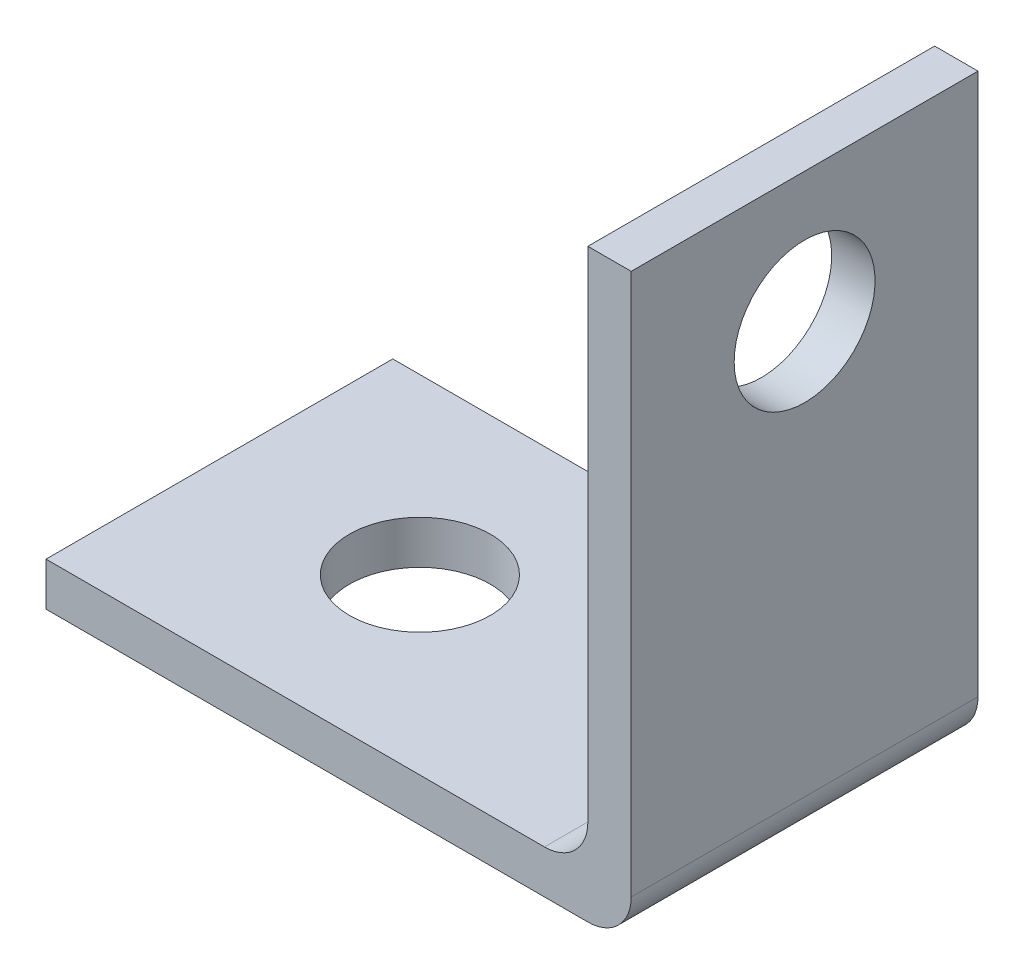
from build123d import *

# Parameters (mm, degrees)
CROQUIS2_W              = 16
CROQUIS2_H              = 2
SALIENTE_EXTRUIR3_DEPTH = 25
CROQUIS3_W              = 16
CROQUIS3_H              = 27
SALIENTE_EXTRUIR4_DEPTH = 2
REDONDEO1_R             = 2
CROQUIS4_R              = 3.25
CORTAR_EXTRUIR1_DEPTH   = 38.656340768
CROQUIS5_R              = 3.25
CORTAR_EXTRUIR2_DEPTH   = 37.945906404


with BuildPart() as part:
    # Croquis2 → Saliente-Extruir3 (new body)
    with BuildSketch(Plane(origin=(0, 0, 0), x_dir=(0, 0, -1), z_dir=(1, 0, 0))):
        Rectangle(CROQUIS2_W, CROQUIS2_H)
    extrude(amount=SALIENTE_EXTRUIR3_DEPTH)

    # Croquis3 → Saliente-Extruir4 (add)
    with BuildSketch(Plane(origin=(25, 0, 0), x_dir=(0, 0, -1), z_dir=(1, 0, 0))):
        with Locations((0, 12.5)):
            Rectangle(CROQUIS3_W, CROQUIS3_H)
    extrude(amount=SALIENTE_EXTRUIR4_DEPTH)

    # Redondeo1
    redondeo1_edges = [part.edges().sort_by_distance(p)[0] for p in [
        (27, -1, 0),
        (25, 1, 0),
    ]]
    fillet(redondeo1_edges, radius=REDONDEO1_R)

    # Croquis4 → Cortar-Extruir1 (cut, through all)
    with BuildSketch(Plane(origin=(0, 1, 0), x_dir=(1, 0, 0), z_dir=(0, 1, 0))):
        with Locations(Location((9.25, 0, 0), (0, 0, 270))):
            Circle(CROQUIS4_R)
    extrude(amount=-CORTAR_EXTRUIR1_DEPTH, mode=Mode.SUBTRACT)

    # Croquis5 → Cortar-Extruir2 (cut, through all)
    with BuildSketch(Plane.ZY.offset(-25)):
        with Locations((0, 20)):
            Circle(CROQUIS5_R)
    extrude(amount=-CORTAR_EXTRUIR2_DEPTH, mode=Mode.SUBTRACT)


solid = part.part
